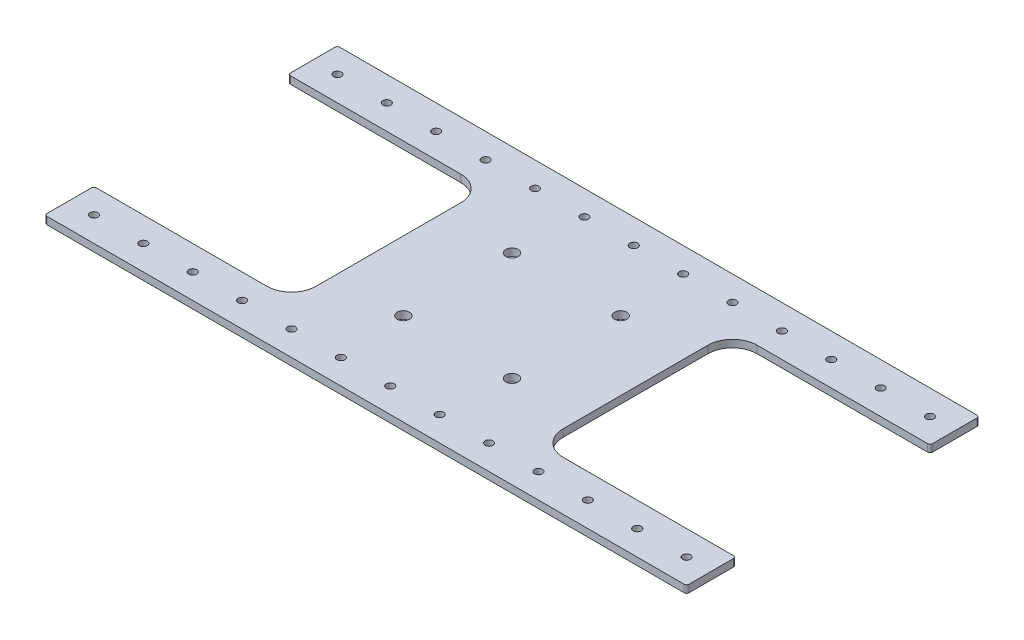
from build123d import *

# Parameters (mm, degrees)
EXTRUDE_1_DEPTH     = 3
CUT_EXTRUDE_START   = -10
CUT_EXTRUDE_1_DEPTH = 10
SKETCH_3_W          = 20
SKETCH_3_H          = 40
EXTRUDE_2_DEPTH     = 3
FILLET_2_R          = 1
FILLET_3_R          = 1
SKETCH_5_R          = 2.5
CUT_EXTRUDE_2_DEPTH = 10
SKETCH_6_R          = 1.6
SKETCH_6_R_2        = 1.5
CUT_EXTRUDE_3_DEPTH = 10
SKETCH_8_R          = 1.5
CUT_EXTRUDE_4_DEPTH = 234.216551728
SKETCH_10_R         = 4
CUT_EXTRUDE_6_DEPTH = 234.216551728
SKETCH_11_W         = 261.88508479
SKETCH_11_H         = 89.465119345
CUT_EXTRUDE_7_DEPTH = 10
SKETCH_12_W         = 216.280597176
SKETCH_12_H         = 5.061990366
EXTRUDE_3_DEPTH     = 3
SKETCH_14_R         = 1.6
CUT_EXTRUDE_8_DEPTH = 234.216551728


with BuildPart() as part:
    # 草图1 → 凸台-拉伸1 (new body)
    with BuildSketch(Plane(origin=(0, 0, 0), x_dir=(1, 0, 0), z_dir=(0, 1, 0))):
        with BuildLine():
            Line((-130, -193.6), (-50, -193.6))
            Line((-50, -193.6), (50, -193.6))
            Line((50, -193.6), (130, -193.6))
            Line((130, -193.6), (130, -173.6))
            Line((130, -173.6), (60, -173.6))
            ThreePointArc((60, -173.6), (52.928932188, -170.671067812), (50, -163.6))
            Line((50, -163.6), (50, -105))
            ThreePointArc((50, -105), (52.928932188, -97.928932188), (60, -95))
            Line((60, -95), (130, -95))
            Line((130, -95), (130, -75))
            Line((130, -75), (130, 75))
            Line((130, 75), (130, 95))
            Line((130, 95), (60, 95))
            ThreePointArc((60, 95), (52.928932188, 97.928932188), (50, 105))
            Line((50, 105), (50, 163.6))
            ThreePointArc((50, 163.6), (52.928932188, 170.671067812), (60, 173.6))
            Line((60, 173.6), (130, 173.6))
            Line((130, 173.6), (130, 193.6))
            Line((130, 193.6), (50, 193.6))
            Line((50, 193.6), (-50, 193.6))
            Line((-50, 193.6), (-130, 193.6))
            Line((-130, 193.6), (-130, 173.6))
            Line((-130, 173.6), (-60, 173.6))
            ThreePointArc((-60, 173.6), (-52.928932188, 170.671067812), (-50, 163.6))
            Line((-50, 163.6), (-50, 105))
            ThreePointArc((-50, 105), (-52.928932188, 97.928932188), (-60, 95))
            Line((-60, 95), (-130, 95))
            Line((-130, 95), (-130, 75))
            Line((-130, 75), (-130, -75))
            Line((-130, -75), (-130, -95))
            Line((-130, -95), (-60, -95))
            ThreePointArc((-60, -95), (-52.928932188, -97.928932188), (-50, -105))
            Line((-50, -105), (-50, -163.6))
            ThreePointArc((-50, -163.6), (-52.928932188, -170.671067812), (-60, -173.6))
            Line((-60, -173.6), (-130, -173.6))
            Line((-130, -173.6), (-130, -193.6))
        make_face()
    extrude(amount=EXTRUDE_1_DEPTH)

    # 草图2 → 切除-拉伸1 (cut)
    with BuildSketch(Plane(origin=(0, 3, 0), x_dir=(1, 0, 0), z_dir=(0, 1, 0)).offset(CUT_EXTRUDE_START)):
        with BuildLine():
            Line((-130, 95), (-130, -75))
            Line((-130, -75), (130, -75))
            Line((130, -75), (130, 95))
            Line((130, 95), (60, 95))
            ThreePointArc((60, 95), (52.928932188, 97.928932188), (50, 105))
            Line((50, 105), (50, 163.6))
            ThreePointArc((50, 163.6), (52.928932188, 170.671067812), (60, 173.6))
            Line((60, 173.6), (130, 173.6))
            Line((130, 173.6), (130, 193.6))
            Line((130, 193.6), (-130, 193.6))
            Line((-130, 193.6), (-130, 173.6))
            Line((-130, 173.6), (-60, 173.6))
            ThreePointArc((-60, 173.6), (-52.928932188, 170.671067812), (-50, 163.6))
            Line((-50, 163.6), (-50, 105))
            ThreePointArc((-50, 105), (-52.928932188, 97.928932188), (-60, 95))
            Line((-60, 95), (-130, 95))
        make_face()
    extrude(amount=CUT_EXTRUDE_1_DEPTH, mode=Mode.SUBTRACT)

    # 草图3 → 凸台-拉伸2 (add)
    with BuildSketch(Plane(origin=(0, 3, 0), x_dir=(1, 0, 0), z_dir=(0, 1, 0))):
        with Locations((90, -55)):
            Rectangle(SKETCH_3_W, SKETCH_3_H)
        with Locations((-90, -55)):
            Rectangle(SKETCH_3_W, SKETCH_3_H)
    extrude(amount=-EXTRUDE_2_DEPTH)

    # 圆角2
    fillet_2_edges = [part.edges().sort_by_distance(p)[0] for p in [
        (-130, 1.5, 75),
        (-100, 1.5, 35),
        (-80, 1.5, 35),
        (-130, 1.5, 193.6),
        (-130, 1.5, 173.6),
        (-130, 1.5, 95),
    ]]
    fillet(fillet_2_edges, radius=FILLET_2_R)

    # 圆角3
    fillet_3_edges = [part.edges().sort_by_distance(p)[0] for p in [
        (130, 1.5, 75),
        (80, 1.5, 35),
        (100, 1.5, 35),
        (130, 1.5, 95),
        (130, 1.5, 173.6),
        (130, 1.5, 193.6),
    ]]
    fillet(fillet_3_edges, radius=FILLET_3_R)

    # 草图5 → 切除-拉伸2 (cut)
    with BuildSketch(Plane(origin=(0, 3, 0), x_dir=(1, 0, 0), z_dir=(0, 1, 0))):
        with Locations(Location((22, -112.3, 0), (0, 0, 270))):
            Circle(SKETCH_5_R)
        with Locations(Location((-22, -112.3, 0), (0, 0, 270))):
            Circle(SKETCH_5_R)
        with Locations(Location((-22, -156.3, 0), (0, 0, 270))):
            Circle(SKETCH_5_R)
        with Locations(Location((22, -156.3, 0), (0, 0, 270))):
            Circle(SKETCH_5_R)
    extrude(amount=-CUT_EXTRUDE_2_DEPTH, mode=Mode.SUBTRACT)

    # 草图6 → 切除-拉伸3 (cut)
    # profile 1 of 26: a face of its own
    with BuildSketch(Plane(origin=(0, 3, 0), x_dir=(1, 0, 0), z_dir=(0, 1, 0))):
        with Locations(Location((-100, -183.6, 0), (0, 0, 270))):
            Circle(SKETCH_6_R)
    # profile 2 of 26: a face of its own
    with BuildSketch(Plane(origin=(0, 3, 0), x_dir=(1, 0, 0), z_dir=(0, 1, 0))):
        with Locations(Location((-120, -183.6, 0), (0, 0, 270))):
            Circle(SKETCH_6_R)
    # profile 3 of 26: a face of its own
    with BuildSketch(Plane(origin=(0, 3, 0), x_dir=(1, 0, 0), z_dir=(0, 1, 0))):
        with Locations(Location((-80, -183.6, 0), (0, 0, 270))):
            Circle(SKETCH_6_R)
    # profile 4 of 26: a face of its own
    with BuildSketch(Plane(origin=(0, 3, 0), x_dir=(1, 0, 0), z_dir=(0, 1, 0))):
        with Locations(Location((-60, -183.6, 0), (0, 0, 270))):
            Circle(SKETCH_6_R)
    # profile 5 of 26: a face of its own
    with BuildSketch(Plane(origin=(0, 3, 0), x_dir=(1, 0, 0), z_dir=(0, 1, 0))):
        with Locations(Location((-40, -183.6, 0), (0, 0, 270))):
            Circle(SKETCH_6_R)
    # profile 6 of 26: a face of its own
    with BuildSketch(Plane(origin=(0, 3, 0), x_dir=(1, 0, 0), z_dir=(0, 1, 0))):
        with Locations(Location((-20, -183.6, 0), (0, 0, 270))):
            Circle(SKETCH_6_R)
    # profile 7 of 26: a face of its own
    with BuildSketch(Plane(origin=(0, 3, 0), x_dir=(1, 0, 0), z_dir=(0, 1, 0))):
        with Locations(Location((0, -183.6, 0), (0, 0, 270))):
            Circle(SKETCH_6_R)
    # profile 8 of 26: a face of its own
    with BuildSketch(Plane(origin=(0, 3, 0), x_dir=(1, 0, 0), z_dir=(0, 1, 0))):
        with Locations(Location((20, -183.6, 0), (0, 0, 270))):
            Circle(SKETCH_6_R)
    # profile 9 of 26: a face of its own
    with BuildSketch(Plane(origin=(0, 3, 0), x_dir=(1, 0, 0), z_dir=(0, 1, 0))):
        with Locations(Location((40, -183.6, 0), (0, 0, 270))):
            Circle(SKETCH_6_R)
    # profile 10 of 26: a face of its own
    with BuildSketch(Plane(origin=(0, 3, 0), x_dir=(1, 0, 0), z_dir=(0, 1, 0))):
        with Locations(Location((60, -183.6, 0), (0, 0, 270))):
            Circle(SKETCH_6_R)
    # profile 11 of 26: a face of its own
    with BuildSketch(Plane(origin=(0, 3, 0), x_dir=(1, 0, 0), z_dir=(0, 1, 0))):
        with Locations(Location((80, -183.6, 0), (0, 0, 270))):
            Circle(SKETCH_6_R)
    # profile 12 of 26: a face of its own
    with BuildSketch(Plane(origin=(0, 3, 0), x_dir=(1, 0, 0), z_dir=(0, 1, 0))):
        with Locations(Location((100, -183.6, 0), (0, 0, 270))):
            Circle(SKETCH_6_R)
    # profile 13 of 26: a face of its own
    with BuildSketch(Plane(origin=(0, 3, 0), x_dir=(1, 0, 0), z_dir=(0, 1, 0))):
        with Locations(Location((120, -183.6, 0), (0, 0, 270))):
            Circle(SKETCH_6_R)
    # profile 14 of 26: a face of its own
    with BuildSketch(Plane(origin=(0, 3, 0), x_dir=(1, 0, 0), z_dir=(0, 1, 0))):
        with Locations(Location((120, -85, 0), (0, 0, 270))):
            Circle(SKETCH_6_R)
    # profile 15 of 26: a face of its own
    with BuildSketch(Plane(origin=(0, 3, 0), x_dir=(1, 0, 0), z_dir=(0, 1, 0))):
        with Locations(Location((100, -85, 0), (0, 0, 270))):
            Circle(SKETCH_6_R)
        with Locations(Location((100, -85, 0), (0, 0, 270))):
            Circle(SKETCH_6_R_2, mode=Mode.SUBTRACT)
    # profile 16 of 26: a face of its own
    with BuildSketch(Plane(origin=(0, 3, 0), x_dir=(1, 0, 0), z_dir=(0, 1, 0))):
        with Locations(Location((80, -85, 0), (0, 0, 270))):
            Circle(SKETCH_6_R_2)
    # profile 17 of 26: a face of its own
    with BuildSketch(Plane(origin=(0, 3, 0), x_dir=(1, 0, 0), z_dir=(0, 1, 0))):
        with Locations(Location((60, -85, 0), (0, 0, 270))):
            Circle(SKETCH_6_R)
        with Locations(Location((60, -85, 0), (0, 0, 270))):
            Circle(SKETCH_6_R_2, mode=Mode.SUBTRACT)
    # profile 18 of 26: a face of its own
    with BuildSketch(Plane(origin=(0, 3, 0), x_dir=(1, 0, 0), z_dir=(0, 1, 0))):
        with Locations(Location((40, -85, 0), (0, 0, 270))):
            Circle(SKETCH_6_R)
        with Locations(Location((40, -85, 0), (0, 0, 270))):
            Circle(SKETCH_6_R_2, mode=Mode.SUBTRACT)
    # profile 19 of 26: a face of its own
    with BuildSketch(Plane(origin=(0, 3, 0), x_dir=(1, 0, 0), z_dir=(0, 1, 0))):
        with Locations(Location((20, -85, 0), (0, 0, 270))):
            Circle(SKETCH_6_R)
        with Locations(Location((20, -85, 0), (0, 0, 270))):
            Circle(SKETCH_6_R_2, mode=Mode.SUBTRACT)
    # profile 20 of 26: a face of its own
    with BuildSketch(Plane(origin=(0, 3, 0), x_dir=(1, 0, 0), z_dir=(0, 1, 0))):
        with Locations(Location((-20, -85, 0), (0, 0, 270))):
            Circle(SKETCH_6_R)
        with Locations(Location((-20, -85, 0), (0, 0, 270))):
            Circle(SKETCH_6_R_2, mode=Mode.SUBTRACT)
    # profile 21 of 26: a face of its own
    with BuildSketch(Plane(origin=(0, 3, 0), x_dir=(1, 0, 0), z_dir=(0, 1, 0))):
        with Locations(Location((0, -85, 0), (0, 0, 270))):
            Circle(SKETCH_6_R_2)
    # profile 22 of 26: a face of its own
    with BuildSketch(Plane(origin=(0, 3, 0), x_dir=(1, 0, 0), z_dir=(0, 1, 0))):
        with Locations(Location((-40, -85, 0), (0, 0, 270))):
            Circle(SKETCH_6_R)
        with Locations(Location((-40, -85, 0), (0, 0, 270))):
            Circle(SKETCH_6_R_2, mode=Mode.SUBTRACT)
    # profile 23 of 26: a face of its own
    with BuildSketch(Plane(origin=(0, 3, 0), x_dir=(1, 0, 0), z_dir=(0, 1, 0))):
        with Locations(Location((-60, -85, 0), (0, 0, 270))):
            Circle(SKETCH_6_R)
        with Locations(Location((-60, -85, 0), (0, 0, 270))):
            Circle(SKETCH_6_R_2, mode=Mode.SUBTRACT)
    # profile 24 of 26: a face of its own
    with BuildSketch(Plane(origin=(0, 3, 0), x_dir=(1, 0, 0), z_dir=(0, 1, 0))):
        with Locations(Location((-80, -85, 0), (0, 0, 270))):
            Circle(SKETCH_6_R)
        with Locations(Location((-80, -85, 0), (0, 0, 270))):
            Circle(SKETCH_6_R_2, mode=Mode.SUBTRACT)
    # profile 25 of 26: a face of its own
    with BuildSketch(Plane(origin=(0, 3, 0), x_dir=(1, 0, 0), z_dir=(0, 1, 0))):
        with Locations(Location((-100, -85, 0), (0, 0, 270))):
            Circle(SKETCH_6_R)
        with Locations(Location((-100, -85, 0), (0, 0, 270))):
            Circle(SKETCH_6_R_2, mode=Mode.SUBTRACT)
    # profile 26 of 26: a face of its own
    with BuildSketch(Plane(origin=(0, 3, 0), x_dir=(1, 0, 0), z_dir=(0, 1, 0))):
        with Locations(Location((-120, -85, 0), (0, 0, 270))):
            Circle(SKETCH_6_R)
    extrude(amount=-CUT_EXTRUDE_3_DEPTH, mode=Mode.SUBTRACT)


with BuildPart() as cut_extrude_3_piece_1:
    # of the separate pieces the step leaves, piece 1, a body of its own (cut_extrude_3_pieces)
    add(part.part.solids().sort_by_distance((129, 3, 193.6))[0])

    # 草图8 → 切除-拉伸4 (cut, through all)
    with BuildSketch(Plane.XZ):
        with Locations(Location((-90, 40, 0), (0, 0, 270))):
            Circle(SKETCH_8_R)
        with Locations(Location((-90, 60, 0), (0, 0, 270))):
            Circle(SKETCH_8_R)
        with Locations(Location((90, 60, 0), (0, 0, 270))):
            Circle(SKETCH_8_R)
        with Locations(Location((90, 40, 0), (0, 0, 270))):
            Circle(SKETCH_8_R)
    extrude(amount=-CUT_EXTRUDE_4_DEPTH, mode=Mode.SUBTRACT)

    # 草图10 → 切除-拉伸6 (cut, through all)
    with BuildSketch(Plane(origin=(0, 3, 0), x_dir=(1, 0, 0), z_dir=(0, 1, 0))):
        with Locations((-100, -75)):
            Circle(SKETCH_10_R)
        with Locations((-80, -75)):
            Circle(SKETCH_10_R)
        with Locations((80, -75)):
            Circle(SKETCH_10_R)
        with Locations((100, -75)):
            Circle(SKETCH_10_R)
    extrude(amount=-CUT_EXTRUDE_6_DEPTH, mode=Mode.SUBTRACT)

    # 草图11 → 切除-拉伸7 (cut)
    with BuildSketch(Plane(origin=(0, 3, 0), x_dir=(1, 0, 0), z_dir=(0, 1, 0))):
        with Locations((10.499402025, -30.267440327)):
            Rectangle(SKETCH_11_W, SKETCH_11_H)
    extrude(amount=-CUT_EXTRUDE_7_DEPTH, mode=Mode.SUBTRACT)

    # 草图12 → 凸台-拉伸3 (add)
    with BuildSketch(Plane(origin=(0, 3, 0), x_dir=(1, 0, 0), z_dir=(0, 1, 0))):
        with Locations((2.776697739, -77.530995183)):
            Rectangle(SKETCH_12_W, SKETCH_12_H)
    extrude(amount=-EXTRUDE_3_DEPTH)


with BuildPart() as cut_extrude_3_piece_2:
    # of the separate pieces the step leaves, piece 2, a body of its own (cut_extrude_3_pieces)
    add(part.part.solids().sort_by_distance((-60, 3, 86.5))[0])


with BuildPart() as cut_extrude_3_piece_3:
    # of the separate pieces the step leaves, piece 3, a body of its own (cut_extrude_3_pieces)
    add(part.part.solids().sort_by_distance((60, 3, 86.5))[0])


with BuildPart() as cut_extrude_3_piece_4:
    # of the separate pieces the step leaves, piece 4, a body of its own (cut_extrude_3_pieces)
    add(part.part.solids().sort_by_distance((-100, 3, 86.5))[0])


with BuildPart() as cut_extrude_3_piece_5:
    # of the separate pieces the step leaves, piece 5, a body of its own (cut_extrude_3_pieces)
    add(part.part.solids().sort_by_distance((-80, 3, 86.5))[0])


with BuildPart() as cut_extrude_3_piece_6:
    # of the separate pieces the step leaves, piece 6, a body of its own (cut_extrude_3_pieces)
    add(part.part.solids().sort_by_distance((100, 3, 86.5))[0])


with BuildPart() as cut_extrude_3_piece_7:
    # of the separate pieces the step leaves, piece 7, a body of its own (cut_extrude_3_pieces)
    add(part.part.solids().sort_by_distance((-20, 3, 86.5))[0])


with BuildPart() as cut_extrude_3_piece_8:
    # of the separate pieces the step leaves, piece 8, a body of its own (cut_extrude_3_pieces)
    add(part.part.solids().sort_by_distance((20, 3, 86.5))[0])


with BuildPart() as cut_extrude_3_piece_9:
    # of the separate pieces the step leaves, piece 9, a body of its own (cut_extrude_3_pieces)
    add(part.part.solids().sort_by_distance((40, 3, 86.5))[0])


with BuildPart() as cut_extrude_3_piece_10:
    # of the separate pieces the step leaves, piece 10, a body of its own (cut_extrude_3_pieces)
    add(part.part.solids().sort_by_distance((-40, 3, 86.5))[0])


with BuildPart() as cut_extrude_8_tool:
    # 草图14 → 切除-拉伸8 (new, through all)
    with BuildSketch(Plane(origin=(0, 3, 0), x_dir=(1, 0, 0), z_dir=(0, 1, 0))):
        with Locations(Location((-120, -85, 0), (0, 0, 270))):
            Circle(SKETCH_14_R)
        with Locations(Location((-100, -85, 0), (0, 0, 270))):
            Circle(SKETCH_14_R)
        with Locations(Location((-80, -85, 0), (0, 0, 270))):
            Circle(SKETCH_14_R)
        with Locations(Location((-60, -85, 0), (0, 0, 270))):
            Circle(SKETCH_14_R)
        with Locations(Location((-40, -85, 0), (0, 0, 270))):
            Circle(SKETCH_14_R)
        with Locations(Location((-20, -85, 0), (0, 0, 270))):
            Circle(SKETCH_14_R)
        with Locations(Location((0, -85, 0), (0, 0, 270))):
            Circle(SKETCH_14_R)
        with Locations(Location((20, -85, 0), (0, 0, 270))):
            Circle(SKETCH_14_R)
        with Locations(Location((40, -85, 0), (0, 0, 270))):
            Circle(SKETCH_14_R)
        with Locations(Location((60, -85, 0), (0, 0, 270))):
            Circle(SKETCH_14_R)
        with Locations(Location((80, -85, 0), (0, 0, 270))):
            Circle(SKETCH_14_R)
        with Locations(Location((100, -85, 0), (0, 0, 270))):
            Circle(SKETCH_14_R)
        with Locations(Location((120, -85, 0), (0, 0, 270))):
            Circle(SKETCH_14_R)
    extrude(amount=-CUT_EXTRUDE_8_DEPTH)


with BuildPart() as cut_extrude_3_piece_1_1:
    add(cut_extrude_3_piece_1.part)

    # 切除-拉伸8: cut by cut_extrude_8_tool
    add(cut_extrude_8_tool.part, mode=Mode.SUBTRACT)


with BuildPart() as cut_extrude_3_piece_2_1:
    add(cut_extrude_3_piece_2.part)

    # 切除-拉伸8: cut by cut_extrude_8_tool
    add(cut_extrude_8_tool.part, mode=Mode.SUBTRACT)


with BuildPart() as cut_extrude_3_piece_3_1:
    add(cut_extrude_3_piece_3.part)

    # 切除-拉伸8: cut by cut_extrude_8_tool
    add(cut_extrude_8_tool.part, mode=Mode.SUBTRACT)


with BuildPart() as cut_extrude_3_piece_4_1:
    add(cut_extrude_3_piece_4.part)

    # 切除-拉伸8: cut by cut_extrude_8_tool
    add(cut_extrude_8_tool.part, mode=Mode.SUBTRACT)


with BuildPart() as cut_extrude_3_piece_5_1:
    add(cut_extrude_3_piece_5.part)

    # 切除-拉伸8: cut by cut_extrude_8_tool
    add(cut_extrude_8_tool.part, mode=Mode.SUBTRACT)


with BuildPart() as cut_extrude_3_piece_6_1:
    add(cut_extrude_3_piece_6.part)

    # 切除-拉伸8: cut by cut_extrude_8_tool
    add(cut_extrude_8_tool.part, mode=Mode.SUBTRACT)


with BuildPart() as cut_extrude_3_piece_7_1:
    add(cut_extrude_3_piece_7.part)

    # 切除-拉伸8: cut by cut_extrude_8_tool
    add(cut_extrude_8_tool.part, mode=Mode.SUBTRACT)


with BuildPart() as cut_extrude_3_piece_8_1:
    add(cut_extrude_3_piece_8.part)

    # 切除-拉伸8: cut by cut_extrude_8_tool
    add(cut_extrude_8_tool.part, mode=Mode.SUBTRACT)


with BuildPart() as cut_extrude_3_piece_9_1:
    add(cut_extrude_3_piece_9.part)

    # 切除-拉伸8: cut by cut_extrude_8_tool
    add(cut_extrude_8_tool.part, mode=Mode.SUBTRACT)


with BuildPart() as cut_extrude_3_piece_10_1:
    add(cut_extrude_3_piece_10.part)

    # 切除-拉伸8: cut by cut_extrude_8_tool
    add(cut_extrude_8_tool.part, mode=Mode.SUBTRACT)


solid = cut_extrude_3_piece_1_1.part
